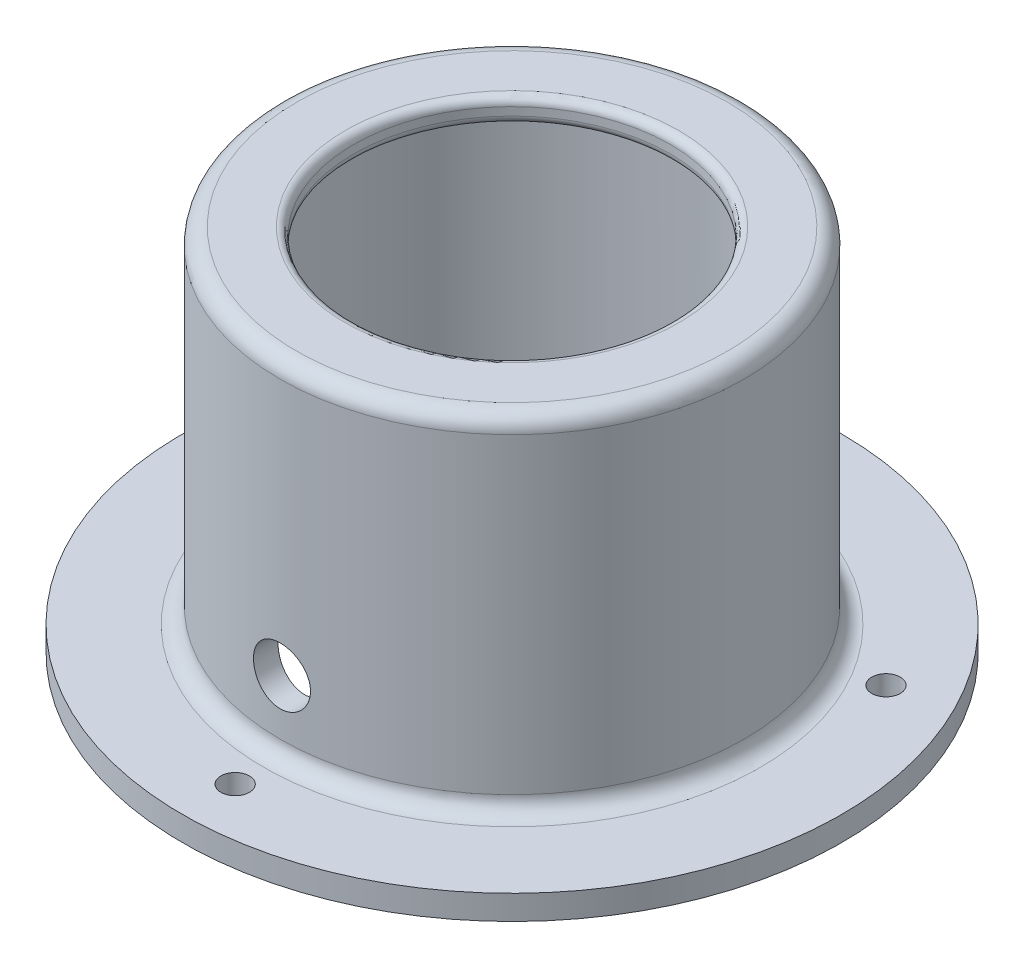
from build123d import *

# Parameters (mm, degrees)
FILLET1_R               = 2
CUT_EXTRUDE1_DEPTH      = 72.147790373
CUT_EXTRUDE1_DEPTH_BACK = 72.147790373
SKETCH2_R               = 1.75
FILLET2_R               = 2
FILLET3_R               = 1
CUT_EXTRUDE2_DEPTH      = 73.970254728
SKETCH4_R               = 3.5
CUT_EXTRUDE3_DEPTH      = 73.970254728


with BuildPart() as part:
    # Sketch1 → Revolve1 (revolve)
    with BuildSketch(Plane.XY, mode=Mode.PRIVATE) as revolve1_sk:
        Polygon((-19.465, 45.275), (-19.465, 42.275), (-25.465, 42.275), (-25.465, 0), (-40.465, 0), (-40.465, 3), (-28.465, 3), (-28.465, 45.275), align=None)
    revolve(revolve1_sk.sketch.rotate(Axis((0, 0, 0), (0, 1, 0)), 270), axis=Axis((0, 0, 0), (0, 1, 0)))

    # Fillet1
    fillet1_edges = [part.edges().sort_by_distance(p)[0] for p in [
        (0, 45.275, 28.465),
        (0, 42.275, 25.465),
    ]]
    fillet(fillet1_edges, radius=FILLET1_R)

    # Sketch2 → Cut-Extrude1 (cut, two sides: drawn at the far end of the back side and taken through both)
    with BuildSketch(Plane(origin=(0, 3, 0), x_dir=(1, 0, 0), z_dir=(0, 1, 0)).offset(-CUT_EXTRUDE1_DEPTH_BACK)):
        with Locations(Location((0, -34, 0), (0, 0, 270))):
            Circle(SKETCH2_R)
        with Locations(Location((-28.981540138, 16.7325, 0), (0, 0, 270))):
            Circle(SKETCH2_R)
        with Locations(Location((29.444863729, 16.465, 0), (0, 0, 270))):
            Circle(SKETCH2_R)
    extrude(amount=CUT_EXTRUDE1_DEPTH + CUT_EXTRUDE1_DEPTH_BACK, mode=Mode.SUBTRACT)

    # Fillet2
    fillet2_edges = [part.edges().sort_by_distance(p)[0] for p in [
        (0, 3, 28.465),
        (0, 0, 25.465),
    ]]
    fillet(fillet2_edges, radius=FILLET2_R)

    # Fillet3
    fillet3_edges = [part.edges().sort_by_distance(p)[0] for p in [
        (0, 45.275, 19.465),
        (0, 42.275, 19.465),
    ]]
    fillet(fillet3_edges, radius=FILLET3_R)

    # Sketch3 → Cut-Extrude2 (cut, through all)
    with BuildSketch(Plane.XY):
        with BuildLine():
            Line((7.5, 8.24), (-7.5, 8.24))
            ThreePointArc((-7.5, 8.24), (-11, 11.74), (-7.5, 15.24))
            Line((-7.5, 15.24), (7.5, 15.24))
            ThreePointArc((7.5, 15.24), (11, 11.74), (7.5, 8.24))
        make_face()
    extrude(amount=-CUT_EXTRUDE2_DEPTH, mode=Mode.SUBTRACT)

    # Sketch4 → Cut-Extrude3 (cut, through all)
    with BuildSketch(Plane.XY):
        with Locations(Location((0, 11.74, 0), (0, 0, 180))):
            Circle(SKETCH4_R)
    extrude(amount=CUT_EXTRUDE3_DEPTH, mode=Mode.SUBTRACT)


solid = part.part
